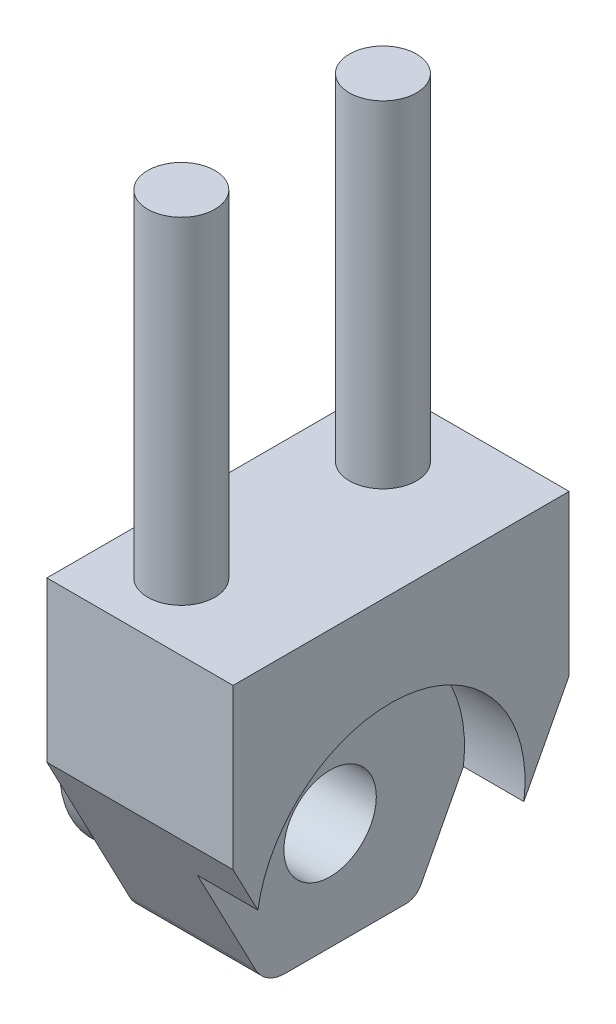
from build123d import *

# Parameters (mm, degrees)
ESQUISSE1_W             = 22.16
ESQUISSE1_H             = 40
BOSS_EXTRU_1_DEPTH      = 40
CHANFREIN1_SIZE         = 11
CHANFREIN1_SIZE2        = 21
CHANFREIN2_SIZE         = 11
CHANFREIN2_SIZE2        = 21
CONG_1_R                = 4
ESQUISSE2_R             = 4
BOSS_EXTRU_2_DEPTH      = 40
ESQUISSE2_3_R           = 4
BOSS_EXTRU_3_DEPTH      = 40
ESQUISSE3_R             = 12.5
BOSS_EXTRU_4_DEPTH      = 6
ESQUISSE4_R             = 16
ENL_V_MAT_EXTRU_1_DEPTH = 7.2
ESQUISSE6_W             = 12.088624029
ESQUISSE6_H             = 7.650078289
ENL_V_MAT_EXTRU_2_DEPTH = 86.171439898
CONG_2_R                = 2
ESQUISSE8_R             = 5.5
ENL_V_MAT_EXTRU_5_DEPTH = 15


with BuildPart() as part:
    # Esquisse1 → Boss.-Extru.1 (new body)
    with BuildSketch(Plane(origin=(0, 0, 0), x_dir=(1, 0, 0), z_dir=(0, 1, 0))):
        with Locations((26.894106866, -0.367930046)):
            Rectangle(ESQUISSE1_W, ESQUISSE1_H)
    extrude(amount=BOSS_EXTRU_1_DEPTH)

    # Chanfrein1
    chanfrein1_edges = [part.edges().sort_by_distance(p)[0] for p in [
        (26.894106866, 0, 20.367930046),
    ]]
    chanfrein1_side = [part.faces().sort_by_distance(p)[0] for p in [
        (26.894106866, 0, 0.367930046),
    ]]
    chamfer(chanfrein1_edges, length=CHANFREIN1_SIZE, length2=CHANFREIN1_SIZE2, reference=chanfrein1_side[0])

    # Chanfrein2
    chanfrein2_edges = [part.edges().sort_by_distance(p)[0] for p in [
        (26.894106866, 0, -19.632069954),
    ]]
    chanfrein2_side = [part.faces().sort_by_distance(p)[0] for p in [
        (26.894106866, 0, -5.132069954),
    ]]
    chamfer(chanfrein2_edges, length=CHANFREIN2_SIZE, length2=CHANFREIN2_SIZE2, reference=chanfrein2_side[0])

    # Congé1
    cong_1_edges = [part.edges().sort_by_distance(p)[0] for p in [
        (26.894106866, 0, 9.367930046),
    ]]
    fillet(cong_1_edges, radius=CONG_1_R)

    # Esquisse2 → Boss.-Extru.2 (add)
    with BuildSketch(Plane(origin=(0, 40, 0), x_dir=(1, 0, 0), z_dir=(0, 1, 0))):
        with Locations((23.814106866, 11.632069954)):
            Circle(ESQUISSE2_R)
    extrude(amount=BOSS_EXTRU_2_DEPTH)

    # Esquisse2<3> → Boss.-Extru.3 (add)
    with BuildSketch(Plane(origin=(0, 40, 0), x_dir=(1, 0, 0), z_dir=(0, 1, 0))):
        with Locations((23.814106866, -12.367930046)):
            Circle(ESQUISSE2_3_R)
        with Locations((23.814106866, 11.632069954)):
            Circle(ESQUISSE2_3_R)
    extrude(amount=BOSS_EXTRU_3_DEPTH)

    # Esquisse3 → Boss.-Extru.4 (add)
    with BuildSketch(Plane.ZY.offset(-15.814106866)):
        with Locations((0.367930046, 13.5)):
            Circle(ESQUISSE3_R)
    extrude(amount=BOSS_EXTRU_4_DEPTH)

    # Esquisse4 → Enlèv. mat.-Extru.1 (cut)
    with BuildSketch(Plane(origin=(37.974106866, 0, 0), x_dir=(0, 0, -1), z_dir=(1, 0, 0))):
        with Locations((-1.617930046, 12.8)):
            Circle(ESQUISSE4_R)
    extrude(amount=-ENL_V_MAT_EXTRU_1_DEPTH, mode=Mode.SUBTRACT)

    # Esquisse6 → Enlèv. mat.-Extru.2 (cut, through all)
    with BuildSketch(Plane(origin=(30.774106866, 0, 0), x_dir=(0, 0, -1), z_dir=(1, 0, 0))):
        with Locations((6.871590707, 0.920255373)):
            Rectangle(ESQUISSE6_W, ESQUISSE6_H)
    extrude(amount=ENL_V_MAT_EXTRU_2_DEPTH, mode=Mode.SUBTRACT)

    # Congé2
    cong_2_edges = [part.edges().sort_by_distance(p)[0] for p in [
        (23.294106866, 0, -8.632069954),
    ]]
    fillet(cong_2_edges, radius=CONG_2_R)

    # Esquisse8 → Enlèv. mat.-Extru.5 (cut)
    with BuildSketch(Plane(origin=(37.974106866, 0, -37.974106866), x_dir=(0, 0, 1), z_dir=(-1, 0, 0))):
        with Locations((39.592036913, 12.8)):
            Circle(ESQUISSE8_R)
    extrude(amount=ENL_V_MAT_EXTRU_5_DEPTH, mode=Mode.SUBTRACT)


solid = part.part
